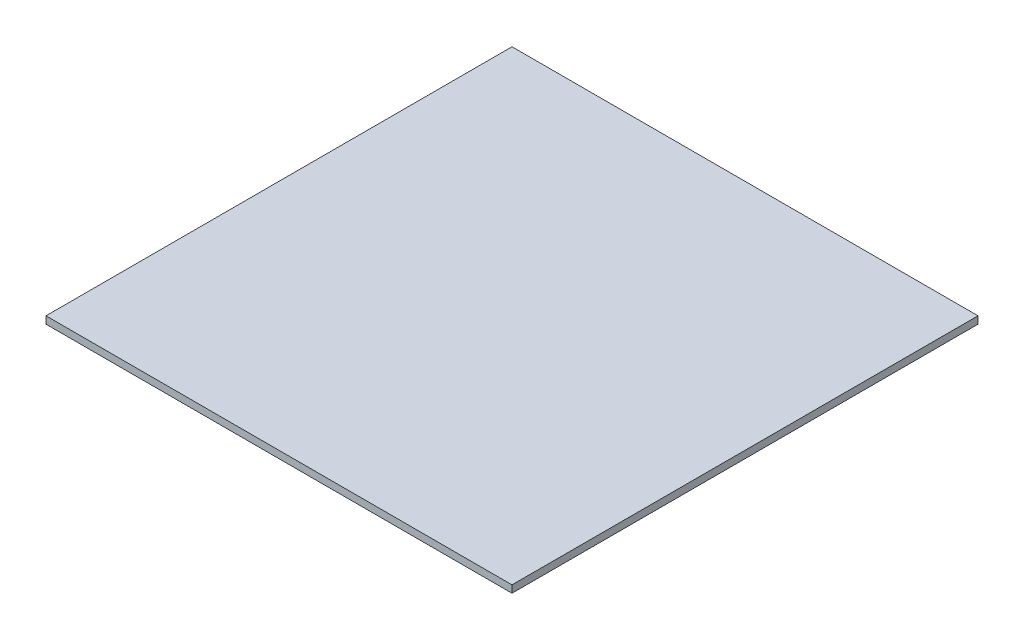
from build123d import *

# Parameters (mm, degrees)
SKETCH1_W      = 1219.2
SKETCH1_H      = 1219.2
EXTRUDE1_DEPTH = 19.05


with BuildPart() as part:
    # Sketch1 → Extrude1 (new body)
    with BuildSketch(Plane(origin=(0, 0, 0), x_dir=(1, 0, 0), z_dir=(0, 1, 0))):
        with Locations((0, 609.6)):
            Rectangle(SKETCH1_W, SKETCH1_H)
    extrude(amount=-EXTRUDE1_DEPTH)


solid = part.part
